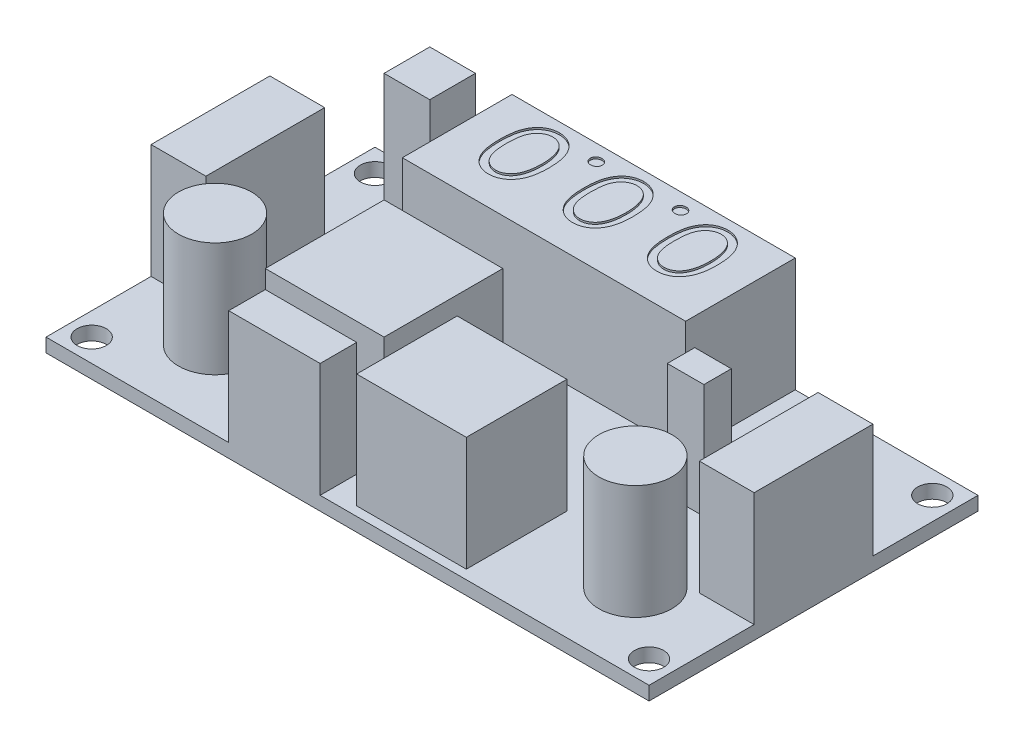
from build123d import *

# Parameters (mm, degrees)
SKETCH_2_W          = 66
SKETCH_2_H          = 36
EXTRUDE_1_DEPTH     = 1.5
SKETCH_3_R          = 4
SKETCH_3_W          = 6
SKETCH_3_H          = 13
SKETCH_3_W_2        = 10
SKETCH_3_H_2        = 4
SKETCH_3_W_3        = 12
SKETCH_3_H_3        = 11
SKETCH_3_W_4        = 5
SKETCH_3_H_4        = 5
SKETCH_3_W_5        = 31
SKETCH_3_H_5        = 12
SKETCH_3_W_6        = 4
SKETCH_3_H_6        = 3
SKETCH_3_W_7        = 13
EXTRUDE_2_DEPTH     = 12.5
SKETCH_3_2_R        = 4
SKETCH_3_2_W        = 6
SKETCH_3_2_H        = 13
SKETCH_3_2_W_2      = 10
SKETCH_3_2_H_2      = 4
SKETCH_3_2_W_3      = 12
SKETCH_3_2_H_3      = 11
SKETCH_3_2_W_4      = 5
SKETCH_3_2_H_4      = 5
SKETCH_3_2_W_5      = 31
SKETCH_3_2_H_5      = 12
SKETCH_3_2_W_6      = 4
SKETCH_3_2_H_6      = 3
SKETCH_3_2_W_7      = 13
EXTRUDE_3_DEPTH     = 8
CUT_EXTRUDE_1_DEPTH = 0.2
SKETCH_6_R          = 1.6
CUT_EXTRUDE_2_DEPTH = 40.613760313


with BuildPart() as part:
    # 스케치2 → 보스-돌출1 (new body)
    with BuildSketch(Plane(origin=(0, 0, 0), x_dir=(1, 0, 0), z_dir=(0, 1, 0))):
        Rectangle(SKETCH_2_W, SKETCH_2_H)
    extrude(amount=EXTRUDE_1_DEPTH)

    # 스케치3 → 보스-돌출2 (add)
    with BuildSketch(Plane(origin=(0, 1.5, 0), x_dir=(1, 0, 0), z_dir=(0, 1, 0))):
        with Locations(Location((-23, -9.5, 0), (0, 0, 270))):
            Circle(SKETCH_3_R)
        with Locations(Location((23, -9.5, 0), (0, 0, 270))):
            Circle(SKETCH_3_R)
        with Locations((-30, 0)):
            Rectangle(SKETCH_3_W, SKETCH_3_H)
        with Locations((30, 0)):
            Rectangle(SKETCH_3_W, SKETCH_3_H)
        with Locations((-8, -16)):
            Rectangle(SKETCH_3_W_2, SKETCH_3_H_2)
        with Locations((6, -11.5)):
            Rectangle(SKETCH_3_W_3, SKETCH_3_H_3)
        with Locations((-24.5, 15.5)):
            Rectangle(SKETCH_3_W_4, SKETCH_3_H_4)
        with Locations((-2.5, 12)):
            Rectangle(SKETCH_3_W_5, SKETCH_3_H_5)
        with Locations((18, 2.5)):
            Rectangle(SKETCH_3_W_6, SKETCH_3_H_6)
        with Locations((-8.5, -5.5)):
            Rectangle(SKETCH_3_W_7, SKETCH_3_H)
    extrude(amount=EXTRUDE_2_DEPTH)

    # 스케치3<2> → 보스-돌출3 (add)
    with BuildSketch(Plane(origin=(0, 1.5, 0), x_dir=(1, 0, 0), z_dir=(0, 1, 0))):
        with Locations(Location((-23, -9.5, 0), (0, 0, 270))):
            Circle(SKETCH_3_2_R)
        with Locations(Location((23, -9.5, 0), (0, 0, 270))):
            Circle(SKETCH_3_2_R)
        with Locations((-30, 0)):
            Rectangle(SKETCH_3_2_W, SKETCH_3_2_H)
        with Locations((30, 0)):
            Rectangle(SKETCH_3_2_W, SKETCH_3_2_H)
        with Locations((-8, -16)):
            Rectangle(SKETCH_3_2_W_2, SKETCH_3_2_H_2)
        with Locations((6, -11.5)):
            Rectangle(SKETCH_3_2_W_3, SKETCH_3_2_H_3)
        with Locations((-24.5, 15.5)):
            Rectangle(SKETCH_3_2_W_4, SKETCH_3_2_H_4)
        with Locations((-2.5, 12)):
            Rectangle(SKETCH_3_2_W_5, SKETCH_3_2_H_5)
        with Locations((18, 2.5)):
            Rectangle(SKETCH_3_2_W_6, SKETCH_3_2_H_6)
        with Locations((-8.5, -5.5)):
            Rectangle(SKETCH_3_2_W_7, SKETCH_3_2_H)
    extrude(amount=EXTRUDE_3_DEPTH)

    # 스케치5 → 컷-돌출1 (cut)
    # profile 1 of 5: a face of its own
    with BuildSketch(Plane(origin=(0, 14, 0), x_dir=(1, 0, 0), z_dir=(0, 1, 0))):
        with BuildLine():
            add(Edge.make_bspline(
                [(-14.419818376, 13.063179098), (-14.418459016, 12.944444114), (-14.415818517, 12.713806495), (-14.401742464, 12.377623704), (-14.375072763, 12.062285883), (-14.338366255, 11.767622044), (-14.291258931, 11.494143315), (-14.233785698, 11.241329327), (-14.165921461, 11.009173726), (-14.08708976, 10.796332931), (-13.996291215, 10.60125324), (-13.901260152, 10.417370578), (-13.792646448, 10.248348044), (-13.679613823, 10.088750778), (-13.555462792, 9.942822184), (-13.423164104, 9.808698659), (-13.281713588, 9.686647066), (-13.132298643, 9.577002326), (-12.975840609, 9.481002054), (-12.81604823, 9.39529753), (-12.650041611, 9.326069756), (-12.480114984, 9.267631823), (-12.305555526, 9.221707183), (-12.126003569, 9.188901012), (-11.942413032, 9.169178269), (-11.818342294, 9.167121264), (-11.755964543, 9.166087084)],
                knots=[0, 0, 0, 0, 1.603820526, 3.115352659, 4.543618507, 5.877090555, 7.12496949, 8.290358608, 9.377068129, 10.389796722, 11.352535243, 12.282078455, 13.182987931, 14.063801734, 14.921894113, 15.767618834, 16.606133584, 17.442729412, 18.267853256, 19.083809226, 19.889219235, 20.694268863, 21.509458471, 22.324620696, 23.157687019, 24, 24, 24, 24], degree=3))
            add(Edge.make_bspline(
                [(-11.755964543, 9.166087084), (-11.69257033, 9.16690151), (-11.566419047, 9.168522175), (-11.380312468, 9.19148061), (-11.19770383, 9.220760301), (-11.021186949, 9.268359278), (-10.847719579, 9.325052235), (-10.68084518, 9.399458018), (-10.515805598, 9.481566801), (-10.358097477, 9.580522072), (-10.203936192, 9.689211189), (-10.06127445, 9.814892935), (-9.924104025, 9.950558573), (-9.797633107, 10.101145387), (-9.675856772, 10.263018172), (-9.566344284, 10.440146462), (-9.460812173, 10.627841265), (-9.366069952, 10.830159173), (-9.280804448, 11.048606181), (-9.207099912, 11.284152788), (-9.145295108, 11.53761345), (-9.093214532, 11.807956477), (-9.053509164, 12.096776295), (-9.025825308, 12.403315593), (-9.009618399, 12.72761014), (-9.007251045, 12.949384031), (-9.006036325, 13.063179098)],
                knots=[0, 0, 0, 0, 0.849124811, 1.689715488, 2.510539114, 3.325908167, 4.137358647, 4.95402074, 5.772457427, 6.606036604, 7.446967172, 8.297773036, 9.151081389, 10.030648383, 10.931085971, 11.863757263, 12.819477044, 13.816090959, 14.855312144, 15.960468038, 17.121553026, 18.350425046, 19.649150068, 21.02744367, 22.474742705, 24, 24, 24, 24], degree=3))
            add(Edge.make_bspline(
                [(-9.006036325, 13.063179098), (-9.007278441, 13.176477245), (-9.009704332, 13.397752018), (-9.025555214, 13.720597001), (-9.054022307, 14.025503046), (-9.091749629, 14.312415479), (-9.142142352, 14.581955824), (-9.204041127, 14.833684681), (-9.276616925, 15.067727474), (-9.360017071, 15.284365234), (-9.453963412, 15.485301249), (-9.556642025, 15.673136859), (-9.668098934, 15.848694881), (-9.787609782, 16.011755946), (-9.916353135, 16.161369437), (-10.05321615, 16.298337681), (-10.198427595, 16.423111103), (-10.35218006, 16.534611271), (-10.511199629, 16.633710175), (-10.67625861, 16.718818508), (-10.845163966, 16.791820287), (-11.018931314, 16.850925721), (-11.196889706, 16.897788559), (-11.379177078, 16.929202062), (-11.565933658, 16.951916925), (-11.692079648, 16.953522052), (-11.755964543, 16.954334947)],
                knots=[0, 0, 0, 0, 1.520081338, 2.968765686, 4.335160859, 5.627652958, 6.849941718, 8.012138063, 9.103700889, 10.135327544, 11.12406934, 12.077498399, 13.005454381, 13.912089544, 14.787455801, 15.650966906, 16.507615292, 17.353240407, 18.196753249, 19.019005641, 19.842542719, 20.663186424, 21.479335924, 22.308629464, 23.143428747, 24, 24, 24, 24], degree=3))
            add(Edge.make_bspline(
                [(-11.755964543, 16.954334947), (-11.818341688, 16.953296613), (-11.942411219, 16.951231343), (-12.126010665, 16.93156962), (-12.30493591, 16.898646131), (-12.478894196, 16.853813035), (-12.648932924, 16.798490572), (-12.812579094, 16.725430206), (-12.972710281, 16.643110998), (-13.127767916, 16.547747688), (-13.275806978, 16.439769807), (-13.416191648, 16.318613834), (-13.54857588, 16.184970106), (-13.671616239, 16.037633487), (-13.785847073, 15.877914574), (-13.893450678, 15.706989196), (-13.99081019, 15.522611025), (-14.080716624, 15.325175956), (-14.161690637, 15.111370728), (-14.230453797, 14.878048128), (-14.29035399, 14.625031016), (-14.336271783, 14.351158474), (-14.375490591, 14.057771081), (-14.401658965, 13.743774006), (-14.415825702, 13.410083345), (-14.418463171, 13.18092632), (-14.419818376, 13.063179098)],
                knots=[0, 0, 0, 0, 0.843473943, 1.677688484, 2.493974249, 3.302130162, 4.106148564, 4.909164103, 5.723143196, 6.540196404, 7.368594906, 8.198828777, 9.045719163, 9.910110809, 10.79213864, 11.699953926, 12.639824269, 13.609976902, 14.632717004, 15.729243744, 16.897753418, 18.147352308, 19.483516926, 20.900417599, 22.407348784, 24, 24, 24, 24], degree=3))
        make_face()
        with BuildLine():
            add(Edge.make_bspline(
                [(-13.659989316, 13.060211016), (-13.658873768, 13.159150475), (-13.656708995, 13.351147005), (-13.647520584, 13.629888821), (-13.627185924, 13.890081948), (-13.603477383, 14.131916787), (-13.569370803, 14.35477627), (-13.527311107, 14.558568352), (-13.481735227, 14.744770661), (-13.423462793, 14.91244511), (-13.361751507, 15.067354092), (-13.289519363, 15.209804028), (-13.21234372, 15.343623747), (-13.129885232, 15.469470908), (-13.036911923, 15.583778211), (-12.937881322, 15.689137472), (-12.831672679, 15.784988188), (-12.683059682, 15.897805167), (-12.48839388, 16.016401008), (-12.242534857, 16.117996449), (-11.989762409, 16.182408036), (-11.818172202, 16.190468347), (-11.732219885, 16.194505888)],
                knots=[0, 0, 0, 0, 1.435237426, 2.785143622, 4.044295029, 5.220225752, 6.309111823, 7.312459854, 8.238306333, 9.086944801, 9.885090925, 10.655233517, 11.401058952, 12.125452561, 12.83479975, 13.535272674, 14.221150424, 14.907140765, 16.23985049, 17.51375832, 18.754601236, 20, 20, 20, 20], degree=3))
            add(Edge.make_bspline(
                [(-11.732219885, 16.194505888), (-11.645791965, 16.190986129), (-11.47382212, 16.183982693), (-11.220889101, 16.121297342), (-10.977182632, 16.021229784), (-10.784923902, 15.905240749), (-10.640185416, 15.793304662), (-10.5349456, 15.700005714), (-10.439372171, 15.593623562), (-10.348496999, 15.479594902), (-10.264453389, 15.355426645), (-10.189665717, 15.220372165), (-10.120752099, 15.075612907), (-10.081331437, 14.974398057), (-10.06118957, 14.922682637)],
                knots=[0, 0, 0, 0, 1.385185743, 2.756171583, 4.155232958, 5.601124949, 6.342661806, 7.090292893, 7.854473781, 8.634328457, 9.429191334, 10.257332522, 11.109589353, 12, 12, 12, 12], degree=3))
            add(Edge.make_bspline(
                [(-10.06118957, 14.922682637), (-10.037089396, 14.856675476), (-9.988278298, 14.722988388), (-9.929811715, 14.513914257), (-9.879417223, 14.296010021), (-9.837855087, 14.068202015), (-9.805483398, 13.830504845), (-9.781506837, 13.582516748), (-9.768440726, 13.324514326), (-9.766733139, 13.149267263), (-9.765865385, 13.060211016)],
                knots=[0, 0, 0, 0, 0.889220422, 1.800975616, 2.745784879, 3.719776404, 4.731116931, 5.781652937, 6.872690594, 8, 8, 8, 8], degree=3))
            add(Edge.make_bspline(
                [(-9.765865385, 13.060211016), (-9.766835718, 12.971158338), (-9.768734133, 12.796930713), (-9.780153382, 12.54194698), (-9.801331701, 12.299461586), (-9.828879468, 12.06910909), (-9.865579771, 11.851085325), (-9.911953164, 11.645711884), (-9.965069518, 11.45242692), (-10.025916384, 11.27106584), (-10.093502713, 11.10167809), (-10.170187576, 10.945189559), (-10.251220078, 10.799547064), (-10.338896235, 10.665558505), (-10.432436845, 10.543305162), (-10.532665547, 10.432610366), (-10.638734142, 10.332893065), (-10.78839697, 10.220162531), (-10.982343916, 10.102886486), (-11.226056916, 10.000411775), (-11.477383231, 9.938621465), (-11.647299325, 9.930150005), (-11.732219885, 9.925916144)],
                knots=[0, 0, 0, 0, 1.291783096, 2.527316474, 3.70124162, 4.821780852, 5.891736024, 6.906642583, 7.874574356, 8.798107533, 9.680207395, 10.517815698, 11.324198512, 12.096398539, 12.838403083, 13.554703878, 14.260431922, 14.946441027, 16.269337855, 17.536655128, 18.768871017, 20, 20, 20, 20], degree=3))
            add(Edge.make_bspline(
                [(-11.732219885, 9.925916144), (-11.818620613, 9.930101304), (-11.990498459, 9.938426887), (-12.243948367, 10.000067296), (-12.487822893, 10.103165851), (-12.682272223, 10.219171122), (-12.828801887, 10.332990808), (-12.934455106, 10.427763503), (-13.032953912, 10.532707762), (-13.125336401, 10.646905466), (-13.20901496, 10.771693114), (-13.287320678, 10.904542327), (-13.356499047, 11.047940578), (-13.421183319, 11.201557934), (-13.478143716, 11.370038895), (-13.526584767, 11.556082376), (-13.567783315, 11.761247806), (-13.601455694, 11.985147317), (-13.627761632, 12.227259499), (-13.647397171, 12.488075536), (-13.656746146, 12.767787043), (-13.658886512, 12.960775436), (-13.659989316, 13.060211016)],
                knots=[0, 0, 0, 0, 1.252453284, 2.491518031, 3.758701879, 5.08145943, 5.761706604, 6.447530903, 7.137806832, 7.84709874, 8.575440236, 9.315003832, 10.081904578, 10.882725146, 11.731297479, 12.65887722, 13.669177587, 14.765071275, 15.941676253, 17.200729533, 18.557700407, 20, 20, 20, 20], degree=3))
        make_face(mode=Mode.SUBTRACT)
    # profile 2 of 5: a face of its own
    with BuildSketch(Plane(origin=(0, 14, 0), x_dir=(1, 0, 0), z_dir=(0, 1, 0))):
        with BuildLine():
            add(Edge.make_bspline(
                [(-7.011485043, 15.624634093), (-6.966760584, 15.626994705), (-6.880011776, 15.631573415), (-6.754609424, 15.665132716), (-6.640425351, 15.72266729), (-6.538852461, 15.800866128), (-6.45446157, 15.894932601), (-6.391861839, 16.00111955), (-6.352590604, 16.118112487), (-6.348647161, 16.200134871), (-6.346634615, 16.241995204)],
                knots=[0, 0, 0, 0, 1.063945943, 2.063659206, 3.064204292, 4.088713827, 5.097882974, 6.053126296, 7.006408056, 8, 8, 8, 8], degree=3))
            add(Edge.make_bspline(
                [(-6.346634615, 16.241995204), (-6.34873731, 16.282855374), (-6.35290614, 16.363865259), (-6.391879252, 16.479876771), (-6.45439171, 16.586186004), (-6.539336901, 16.679998688), (-6.639868857, 16.760155804), (-6.75492917, 16.816850985), (-6.879727153, 16.852926239), (-6.966708368, 16.857171114), (-7.011485043, 16.859356315)],
                knots=[0, 0, 0, 0, 0.971742746, 1.926589353, 2.883400742, 3.894226478, 4.927644809, 5.929832326, 6.934307551, 8, 8, 8, 8], degree=3))
            add(Edge.make_bspline(
                [(-7.011485043, 16.859356315), (-7.056261717, 16.857171114), (-7.143242933, 16.852926239), (-7.268040916, 16.816850985), (-7.383101229, 16.760155804), (-7.483633185, 16.679998688), (-7.568578375, 16.586186004), (-7.631090833, 16.479876771), (-7.670063945, 16.363865259), (-7.674232775, 16.282855374), (-7.67633547, 16.241995204)],
                knots=[0, 0, 0, 0, 1.065692449, 2.070167674, 3.072355191, 4.105773522, 5.116599258, 6.073410647, 7.028257254, 8, 8, 8, 8], degree=3))
            add(Edge.make_bspline(
                [(-7.67633547, 16.241995204), (-7.674322924, 16.200134871), (-7.670379481, 16.118112487), (-7.631108246, 16.00111955), (-7.568508515, 15.894932601), (-7.484117624, 15.800866128), (-7.382544735, 15.72266729), (-7.268360662, 15.665132716), (-7.14295831, 15.631573415), (-7.056209502, 15.626994705), (-7.011485043, 15.624634093)],
                knots=[0, 0, 0, 0, 0.993591944, 1.946873704, 2.902117026, 3.911286173, 4.935795708, 5.936340794, 6.936054057, 8, 8, 8, 8], degree=3))
        make_face()
    # profile 3 of 5: a face of its own
    with BuildSketch(Plane(origin=(0, 14, 0), x_dir=(1, 0, 0), z_dir=(0, 1, 0))):
        with BuildLine():
            add(Edge.make_bspline(
                [(-5.206891026, 13.063179098), (-5.205531665, 12.944444114), (-5.202891167, 12.713806495), (-5.188815113, 12.377623704), (-5.162145412, 12.062285883), (-5.125438904, 11.767622044), (-5.078331581, 11.494143315), (-5.020858348, 11.241329327), (-4.952994111, 11.009173726), (-4.87416241, 10.796332931), (-4.783363865, 10.60125324), (-4.688332801, 10.417370578), (-4.579719098, 10.248348044), (-4.466686472, 10.088750778), (-4.342535442, 9.942822184), (-4.210236754, 9.808698659), (-4.068786238, 9.686647066), (-3.919371292, 9.577002326), (-3.762913259, 9.481002054), (-3.603120879, 9.39529753), (-3.437114261, 9.326069756), (-3.267187634, 9.267631823), (-3.092628175, 9.221707183), (-2.913076218, 9.188901012), (-2.729485682, 9.169178269), (-2.605414944, 9.167121264), (-2.543037193, 9.166087084)],
                knots=[0, 0, 0, 0, 1.603820526, 3.115352659, 4.543618507, 5.877090555, 7.12496949, 8.290358608, 9.377068129, 10.389796722, 11.352535243, 12.282078455, 13.182987931, 14.063801734, 14.921894113, 15.767618834, 16.606133584, 17.442729412, 18.267853256, 19.083809226, 19.889219235, 20.694268863, 21.509458471, 22.324620696, 23.157687019, 24, 24, 24, 24], degree=3))
            add(Edge.make_bspline(
                [(-2.543037193, 9.166087084), (-2.47964298, 9.16690151), (-2.353491697, 9.168522175), (-2.167385118, 9.19148061), (-1.984776479, 9.220760301), (-1.808259599, 9.268359278), (-1.634792229, 9.325052235), (-1.467917829, 9.399458018), (-1.302878248, 9.481566801), (-1.145170126, 9.580522072), (-0.991008842, 9.689211189), (-0.848347099, 9.814892935), (-0.711176675, 9.950558573), (-0.584705757, 10.101145387), (-0.462929422, 10.263018172), (-0.353416933, 10.440146462), (-0.247884822, 10.627841265), (-0.153142602, 10.830159173), (-0.067877098, 11.048606181), (0.005827438, 11.284152788), (0.067632243, 11.53761345), (0.119712819, 11.807956477), (0.159418187, 12.096776295), (0.187102042, 12.403315593), (0.203308952, 12.72761014), (0.205676306, 12.949384031), (0.206891026, 13.063179098)],
                knots=[0, 0, 0, 0, 0.849124811, 1.689715488, 2.510539114, 3.325908167, 4.137358647, 4.95402074, 5.772457427, 6.606036604, 7.446967172, 8.297773036, 9.151081389, 10.030648383, 10.931085971, 11.863757263, 12.819477044, 13.816090959, 14.855312144, 15.960468038, 17.121553026, 18.350425046, 19.649150068, 21.02744367, 22.474742705, 24, 24, 24, 24], degree=3))
            add(Edge.make_bspline(
                [(0.206891026, 13.063179098), (0.20564891, 13.176477245), (0.203223019, 13.397752018), (0.187372136, 13.720597001), (0.158905043, 14.025503046), (0.121177721, 14.312415479), (0.070784998, 14.581955824), (0.008886224, 14.833684681), (-0.063689574, 15.067727474), (-0.147089721, 15.284365234), (-0.241036062, 15.485301249), (-0.343714674, 15.673136859), (-0.455171583, 15.848694881), (-0.574682432, 16.011755946), (-0.703425785, 16.161369437), (-0.8402888, 16.298337681), (-0.985500245, 16.423111103), (-1.13925271, 16.534611271), (-1.298272279, 16.633710175), (-1.46333126, 16.718818508), (-1.632236616, 16.791820287), (-1.806003963, 16.850925721), (-1.983962356, 16.897788559), (-2.166249728, 16.929202062), (-2.353006307, 16.951916925), (-2.479152298, 16.953522052), (-2.543037193, 16.954334947)],
                knots=[0, 0, 0, 0, 1.520081338, 2.968765686, 4.335160859, 5.627652958, 6.849941718, 8.012138063, 9.103700889, 10.135327544, 11.12406934, 12.077498399, 13.005454381, 13.912089544, 14.787455801, 15.650966906, 16.507615292, 17.353240407, 18.196753249, 19.019005641, 19.842542719, 20.663186424, 21.479335924, 22.308629464, 23.143428747, 24, 24, 24, 24], degree=3))
            add(Edge.make_bspline(
                [(-2.543037193, 16.954334947), (-2.605414337, 16.953296613), (-2.729483869, 16.951231343), (-2.913083314, 16.93156962), (-3.092008559, 16.898646131), (-3.265966845, 16.853813035), (-3.436005573, 16.798490572), (-3.599651744, 16.725430206), (-3.759782931, 16.643110998), (-3.914840565, 16.547747688), (-4.062879628, 16.439769807), (-4.203264297, 16.318613834), (-4.33564853, 16.184970106), (-4.458688889, 16.037633487), (-4.572919722, 15.877914574), (-4.680523328, 15.706989196), (-4.777882839, 15.522611025), (-4.867789273, 15.325175956), (-4.948763286, 15.111370728), (-5.017526447, 14.878048128), (-5.077426639, 14.625031016), (-5.123344432, 14.351158474), (-5.162563241, 14.057771081), (-5.188731615, 13.743774006), (-5.202898352, 13.410083345), (-5.205535821, 13.18092632), (-5.206891026, 13.063179098)],
                knots=[0, 0, 0, 0, 0.843473943, 1.677688484, 2.493974249, 3.302130162, 4.106148564, 4.909164103, 5.723143196, 6.540196404, 7.368594906, 8.198828777, 9.045719163, 9.910110809, 10.79213864, 11.699953926, 12.639824269, 13.609976902, 14.632717004, 15.729243744, 16.897753418, 18.147352308, 19.483516926, 20.900417599, 22.407348784, 24, 24, 24, 24], degree=3))
        make_face()
        with BuildLine():
            add(Edge.make_bspline(
                [(-4.447061966, 13.060211016), (-4.445946417, 13.159150475), (-4.443781645, 13.351147005), (-4.434593234, 13.629888821), (-4.414258574, 13.890081948), (-4.390550033, 14.131916787), (-4.356443452, 14.35477627), (-4.314383756, 14.558568352), (-4.268807877, 14.744770661), (-4.210535443, 14.91244511), (-4.148824156, 15.067354092), (-4.076592013, 15.209804028), (-3.999416369, 15.343623747), (-3.916957882, 15.469470908), (-3.823984573, 15.583778211), (-3.724953972, 15.689137472), (-3.618745329, 15.784988188), (-3.470132332, 15.897805167), (-3.27546653, 16.016401008), (-3.029607507, 16.117996449), (-2.776835058, 16.182408036), (-2.605244851, 16.190468347), (-2.519292535, 16.194505888)],
                knots=[0, 0, 0, 0, 1.435237426, 2.785143622, 4.044295029, 5.220225752, 6.309111823, 7.312459854, 8.238306333, 9.086944801, 9.885090925, 10.655233517, 11.401058952, 12.125452561, 12.83479975, 13.535272674, 14.221150424, 14.907140765, 16.23985049, 17.51375832, 18.754601236, 20, 20, 20, 20], degree=3))
            add(Edge.make_bspline(
                [(-2.519292535, 16.194505888), (-2.432864615, 16.190986129), (-2.26089477, 16.183982693), (-2.007961751, 16.121297342), (-1.764255282, 16.021229784), (-1.571996552, 15.905240749), (-1.427258065, 15.793304662), (-1.32201825, 15.700005714), (-1.226444821, 15.593623562), (-1.135569648, 15.479594902), (-1.051526039, 15.355426645), (-0.976738367, 15.220372165), (-0.907824748, 15.075612907), (-0.868404087, 14.974398057), (-0.84826222, 14.922682637)],
                knots=[0, 0, 0, 0, 1.385185743, 2.756171583, 4.155232958, 5.601124949, 6.342661806, 7.090292893, 7.854473781, 8.634328457, 9.429191334, 10.257332522, 11.109589353, 12, 12, 12, 12], degree=3))
            add(Edge.make_bspline(
                [(-0.84826222, 14.922682637), (-0.824162046, 14.856675476), (-0.775350948, 14.722988388), (-0.716884364, 14.513914257), (-0.666489873, 14.296010021), (-0.624927736, 14.068202015), (-0.592556047, 13.830504845), (-0.568579486, 13.582516748), (-0.555513376, 13.324514326), (-0.553805788, 13.149267263), (-0.552938034, 13.060211016)],
                knots=[0, 0, 0, 0, 0.889220422, 1.800975616, 2.745784879, 3.719776404, 4.731116931, 5.781652937, 6.872690594, 8, 8, 8, 8], degree=3))
            add(Edge.make_bspline(
                [(-0.552938034, 13.060211016), (-0.553908368, 12.971158338), (-0.555806783, 12.796930713), (-0.567226032, 12.54194698), (-0.588404351, 12.299461586), (-0.615952118, 12.06910909), (-0.65265242, 11.851085325), (-0.699025814, 11.645711884), (-0.752142167, 11.45242692), (-0.812989033, 11.27106584), (-0.880575363, 11.10167809), (-0.957260226, 10.945189559), (-1.038292727, 10.799547064), (-1.125968885, 10.665558505), (-1.219509494, 10.543305162), (-1.319738197, 10.432610366), (-1.425806792, 10.332893065), (-1.57546962, 10.220162531), (-1.769416566, 10.102886486), (-2.013129566, 10.000411775), (-2.264455881, 9.938621465), (-2.434371974, 9.930150005), (-2.519292535, 9.925916144)],
                knots=[0, 0, 0, 0, 1.291783096, 2.527316474, 3.70124162, 4.821780852, 5.891736024, 6.906642583, 7.874574356, 8.798107533, 9.680207395, 10.517815698, 11.324198512, 12.096398539, 12.838403083, 13.554703878, 14.260431922, 14.946441027, 16.269337855, 17.536655128, 18.768871017, 20, 20, 20, 20], degree=3))
            add(Edge.make_bspline(
                [(-2.519292535, 9.925916144), (-2.605693263, 9.930101304), (-2.777571109, 9.938426887), (-3.031021017, 10.000067296), (-3.274895543, 10.103165851), (-3.469344873, 10.219171122), (-3.615874537, 10.332990808), (-3.721527756, 10.427763503), (-3.820026561, 10.532707762), (-3.91240905, 10.646905466), (-3.99608761, 10.771693114), (-4.074393328, 10.904542327), (-4.143571697, 11.047940578), (-4.208255969, 11.201557934), (-4.265216366, 11.370038895), (-4.313657416, 11.556082376), (-4.354855964, 11.761247806), (-4.388528343, 11.985147317), (-4.414834281, 12.227259499), (-4.43446982, 12.488075536), (-4.443818795, 12.767787043), (-4.445959161, 12.960775436), (-4.447061966, 13.060211016)],
                knots=[0, 0, 0, 0, 1.252453284, 2.491518031, 3.758701879, 5.08145943, 5.761706604, 6.447530903, 7.137806832, 7.84709874, 8.575440236, 9.315003832, 10.081904578, 10.882725146, 11.731297479, 12.65887722, 13.669177587, 14.765071275, 15.941676253, 17.200729533, 18.557700407, 20, 20, 20, 20], degree=3))
        make_face(mode=Mode.SUBTRACT)
    # profile 4 of 5: a face of its own
    with BuildSketch(Plane(origin=(0, 14, 0), x_dir=(1, 0, 0), z_dir=(0, 1, 0))):
        with BuildLine():
            add(Edge.make_bspline(
                [(2.201442308, 15.624634093), (2.246166767, 15.626994705), (2.332915574, 15.631573415), (2.458317927, 15.665132716), (2.572501999, 15.72266729), (2.674074889, 15.800866128), (2.75846578, 15.894932601), (2.821065511, 16.00111955), (2.860336746, 16.118112487), (2.864280189, 16.200134871), (2.866292735, 16.241995204)],
                knots=[0, 0, 0, 0, 1.063945943, 2.063659206, 3.064204292, 4.088713827, 5.097882974, 6.053126296, 7.006408056, 8, 8, 8, 8], degree=3))
            add(Edge.make_bspline(
                [(2.866292735, 16.241995204), (2.86419004, 16.282855374), (2.86002121, 16.363865259), (2.821048098, 16.479876771), (2.75853564, 16.586186004), (2.67359045, 16.679998688), (2.573058494, 16.760155804), (2.457998181, 16.816850985), (2.333200198, 16.852926239), (2.246218982, 16.857171114), (2.201442308, 16.859356315)],
                knots=[0, 0, 0, 0, 0.971742746, 1.926589353, 2.883400742, 3.894226478, 4.927644809, 5.929832326, 6.934307551, 8, 8, 8, 8], degree=3))
            add(Edge.make_bspline(
                [(2.201442308, 16.859356315), (2.156665633, 16.857171114), (2.069684418, 16.852926239), (1.944886435, 16.816850985), (1.829826122, 16.760155804), (1.729294166, 16.679998688), (1.644348975, 16.586186004), (1.581836517, 16.479876771), (1.542863405, 16.363865259), (1.538694575, 16.282855374), (1.53659188, 16.241995204)],
                knots=[0, 0, 0, 0, 1.065692449, 2.070167674, 3.072355191, 4.105773522, 5.116599258, 6.073410647, 7.028257254, 8, 8, 8, 8], degree=3))
            add(Edge.make_bspline(
                [(1.53659188, 16.241995204), (1.538604426, 16.200134871), (1.542547869, 16.118112487), (1.581819104, 16.00111955), (1.644418835, 15.894932601), (1.728809726, 15.800866128), (1.830382616, 15.72266729), (1.944566689, 15.665132716), (2.069969041, 15.631573415), (2.156717849, 15.626994705), (2.201442308, 15.624634093)],
                knots=[0, 0, 0, 0, 0.993591944, 1.946873704, 2.902117026, 3.911286173, 4.935795708, 5.936340794, 6.936054057, 8, 8, 8, 8], degree=3))
        make_face()
    # profile 5 of 5: a face of its own
    with BuildSketch(Plane(origin=(0, 14, 0), x_dir=(1, 0, 0), z_dir=(0, 1, 0))):
        with BuildLine():
            add(Edge.make_bspline(
                [(4.006036325, 13.063179098), (4.007395685, 12.944444114), (4.010036184, 12.713806495), (4.024112237, 12.377623704), (4.050781938, 12.062285883), (4.087488446, 11.767622044), (4.13459577, 11.494143315), (4.192069003, 11.241329327), (4.25993324, 11.009173726), (4.33876494, 10.796332931), (4.429563486, 10.60125324), (4.524594549, 10.417370578), (4.633208253, 10.248348044), (4.746240878, 10.088750778), (4.870391909, 9.942822184), (5.002690597, 9.808698659), (5.144141113, 9.686647066), (5.293556058, 9.577002326), (5.450014091, 9.481002054), (5.609806471, 9.39529753), (5.77581309, 9.326069756), (5.945739717, 9.267631823), (6.120299175, 9.221707183), (6.299851132, 9.188901012), (6.483441669, 9.169178269), (6.607512407, 9.167121264), (6.669890158, 9.166087084)],
                knots=[0, 0, 0, 0, 1.603820526, 3.115352659, 4.543618507, 5.877090555, 7.12496949, 8.290358608, 9.377068129, 10.389796722, 11.352535243, 12.282078455, 13.182987931, 14.063801734, 14.921894113, 15.767618834, 16.606133584, 17.442729412, 18.267853256, 19.083809226, 19.889219235, 20.694268863, 21.509458471, 22.324620696, 23.157687019, 24, 24, 24, 24], degree=3))
            add(Edge.make_bspline(
                [(6.669890158, 9.166087084), (6.733284371, 9.16690151), (6.859435653, 9.168522175), (7.045542233, 9.19148061), (7.228150871, 9.220760301), (7.404667752, 9.268359278), (7.578135121, 9.325052235), (7.745009521, 9.399458018), (7.910049103, 9.481566801), (8.067757224, 9.580522072), (8.221918508, 9.689211189), (8.364580251, 9.814892935), (8.501750675, 9.950558573), (8.628221594, 10.101145387), (8.749997929, 10.263018172), (8.859510417, 10.440146462), (8.965042528, 10.627841265), (9.059784749, 10.830159173), (9.145050253, 11.048606181), (9.218754788, 11.284152788), (9.280559593, 11.53761345), (9.332640169, 11.807956477), (9.372345537, 12.096776295), (9.400029393, 12.403315593), (9.416236302, 12.72761014), (9.418603656, 12.949384031), (9.419818376, 13.063179098)],
                knots=[0, 0, 0, 0, 0.849124811, 1.689715488, 2.510539114, 3.325908167, 4.137358647, 4.95402074, 5.772457427, 6.606036604, 7.446967172, 8.297773036, 9.151081389, 10.030648383, 10.931085971, 11.863757263, 12.819477044, 13.816090959, 14.855312144, 15.960468038, 17.121553026, 18.350425046, 19.649150068, 21.02744367, 22.474742705, 24, 24, 24, 24], degree=3))
            add(Edge.make_bspline(
                [(9.419818376, 13.063179098), (9.41857626, 13.176477245), (9.416150369, 13.397752018), (9.400299487, 13.720597001), (9.371832394, 14.025503046), (9.334105072, 14.312415479), (9.283712349, 14.581955824), (9.221813574, 14.833684681), (9.149237776, 15.067727474), (9.06583763, 15.284365234), (8.971891288, 15.485301249), (8.869212676, 15.673136859), (8.757755767, 15.848694881), (8.638244919, 16.011755946), (8.509501566, 16.161369437), (8.372638551, 16.298337681), (8.227427106, 16.423111103), (8.07367464, 16.534611271), (7.914655071, 16.633710175), (7.749596091, 16.718818508), (7.580690735, 16.791820287), (7.406923387, 16.850925721), (7.228964994, 16.897788559), (7.046677623, 16.929202062), (6.859921043, 16.951916925), (6.733775053, 16.953522052), (6.669890158, 16.954334947)],
                knots=[0, 0, 0, 0, 1.520081338, 2.968765686, 4.335160859, 5.627652958, 6.849941718, 8.012138063, 9.103700889, 10.135327544, 11.12406934, 12.077498399, 13.005454381, 13.912089544, 14.787455801, 15.650966906, 16.507615292, 17.353240407, 18.196753249, 19.019005641, 19.842542719, 20.663186424, 21.479335924, 22.308629464, 23.143428747, 24, 24, 24, 24], degree=3))
            add(Edge.make_bspline(
                [(6.669890158, 16.954334947), (6.607513013, 16.953296613), (6.483443482, 16.951231343), (6.299844036, 16.93156962), (6.120918791, 16.898646131), (5.946960505, 16.853813035), (5.776921777, 16.798490572), (5.613275607, 16.725430206), (5.45314442, 16.643110998), (5.298086785, 16.547747688), (5.150047723, 16.439769807), (5.009663053, 16.318613834), (4.877278821, 16.184970106), (4.754238462, 16.037633487), (4.640007628, 15.877914574), (4.532404022, 15.706989196), (4.435044511, 15.522611025), (4.345138077, 15.325175956), (4.264164064, 15.111370728), (4.195400904, 14.878048128), (4.135500711, 14.625031016), (4.089582918, 14.351158474), (4.05036411, 14.057771081), (4.024195735, 13.743774006), (4.010028999, 13.410083345), (4.00739153, 13.18092632), (4.006036325, 13.063179098)],
                knots=[0, 0, 0, 0, 0.843473943, 1.677688484, 2.493974249, 3.302130162, 4.106148564, 4.909164103, 5.723143196, 6.540196404, 7.368594906, 8.198828777, 9.045719163, 9.910110809, 10.79213864, 11.699953926, 12.639824269, 13.609976902, 14.632717004, 15.729243744, 16.897753418, 18.147352308, 19.483516926, 20.900417599, 22.407348784, 24, 24, 24, 24], degree=3))
        make_face()
        with BuildLine():
            add(Edge.make_bspline(
                [(4.765865385, 13.060211016), (4.766980933, 13.159150475), (4.769145706, 13.351147005), (4.778334117, 13.629888821), (4.798668776, 13.890081948), (4.822377317, 14.131916787), (4.856483898, 14.35477627), (4.898543594, 14.558568352), (4.944119474, 14.744770661), (5.002391908, 14.91244511), (5.064103194, 15.067354092), (5.136335337, 15.209804028), (5.213510981, 15.343623747), (5.295969469, 15.469470908), (5.388942778, 15.583778211), (5.487973379, 15.689137472), (5.594182022, 15.784988188), (5.742795018, 15.897805167), (5.937460821, 16.016401008), (6.183319844, 16.117996449), (6.436092292, 16.182408036), (6.607682499, 16.190468347), (6.693634816, 16.194505888)],
                knots=[0, 0, 0, 0, 1.435237426, 2.785143622, 4.044295029, 5.220225752, 6.309111823, 7.312459854, 8.238306333, 9.086944801, 9.885090925, 10.655233517, 11.401058952, 12.125452561, 12.83479975, 13.535272674, 14.221150424, 14.907140765, 16.23985049, 17.51375832, 18.754601236, 20, 20, 20, 20], degree=3))
            add(Edge.make_bspline(
                [(6.693634816, 16.194505888), (6.780062736, 16.190986129), (6.952032581, 16.183982693), (7.2049656, 16.121297342), (7.448672069, 16.021229784), (7.640930799, 15.905240749), (7.785669285, 15.793304662), (7.890909101, 15.700005714), (7.98648253, 15.593623562), (8.077357702, 15.479594902), (8.161401312, 15.355426645), (8.236188984, 15.220372165), (8.305102602, 15.075612907), (8.344523264, 14.974398057), (8.364665131, 14.922682637)],
                knots=[0, 0, 0, 0, 1.385185743, 2.756171583, 4.155232958, 5.601124949, 6.342661806, 7.090292893, 7.854473781, 8.634328457, 9.429191334, 10.257332522, 11.109589353, 12, 12, 12, 12], degree=3))
            add(Edge.make_bspline(
                [(8.364665131, 14.922682637), (8.388765305, 14.856675476), (8.437576403, 14.722988388), (8.496042986, 14.513914257), (8.546437478, 14.296010021), (8.587999614, 14.068202015), (8.620371303, 13.830504845), (8.644347864, 13.582516748), (8.657413974, 13.324514326), (8.659121562, 13.149267263), (8.659989316, 13.060211016)],
                knots=[0, 0, 0, 0, 0.889220422, 1.800975616, 2.745784879, 3.719776404, 4.731116931, 5.781652937, 6.872690594, 8, 8, 8, 8], degree=3))
            add(Edge.make_bspline(
                [(8.659989316, 13.060211016), (8.659018983, 12.971158338), (8.657120568, 12.796930713), (8.645701319, 12.54194698), (8.624523, 12.299461586), (8.596975232, 12.06910909), (8.56027493, 11.851085325), (8.513901536, 11.645711884), (8.460785183, 11.45242692), (8.399938317, 11.27106584), (8.332351987, 11.10167809), (8.255667125, 10.945189559), (8.174634623, 10.799547064), (8.086958466, 10.665558505), (7.993417856, 10.543305162), (7.893189154, 10.432610366), (7.787120559, 10.332893065), (7.637457731, 10.220162531), (7.443510785, 10.102886486), (7.199797785, 10.000411775), (6.94847147, 9.938621465), (6.778555376, 9.930150005), (6.693634816, 9.925916144)],
                knots=[0, 0, 0, 0, 1.291783096, 2.527316474, 3.70124162, 4.821780852, 5.891736024, 6.906642583, 7.874574356, 8.798107533, 9.680207395, 10.517815698, 11.324198512, 12.096398539, 12.838403083, 13.554703878, 14.260431922, 14.946441027, 16.269337855, 17.536655128, 18.768871017, 20, 20, 20, 20], degree=3))
            add(Edge.make_bspline(
                [(6.693634816, 9.925916144), (6.607234087, 9.930101304), (6.435356241, 9.938426887), (6.181906333, 10.000067296), (5.938031807, 10.103165851), (5.743582478, 10.219171122), (5.597052814, 10.332990808), (5.491399595, 10.427763503), (5.392900789, 10.532707762), (5.3005183, 10.646905466), (5.216839741, 10.771693114), (5.138534023, 10.904542327), (5.069355654, 11.047940578), (5.004671381, 11.201557934), (4.947710985, 11.370038895), (4.899269934, 11.556082376), (4.858071386, 11.761247806), (4.824399007, 11.985147317), (4.798093069, 12.227259499), (4.77845753, 12.488075536), (4.769108555, 12.767787043), (4.766968189, 12.960775436), (4.765865385, 13.060211016)],
                knots=[0, 0, 0, 0, 1.252453284, 2.491518031, 3.758701879, 5.08145943, 5.761706604, 6.447530903, 7.137806832, 7.84709874, 8.575440236, 9.315003832, 10.081904578, 10.882725146, 11.731297479, 12.65887722, 13.669177587, 14.765071275, 15.941676253, 17.200729533, 18.557700407, 20, 20, 20, 20], degree=3))
        make_face(mode=Mode.SUBTRACT)
    extrude(amount=-CUT_EXTRUDE_1_DEPTH, mode=Mode.SUBTRACT)

    # 스케치6 → 컷-돌출2 (cut, through all)
    with BuildSketch(Plane(origin=(0, 1.5, 0), x_dir=(1, 0, 0), z_dir=(0, 1, 0))):
        with Locations(Location((-30.5, 15.5, 0), (0, 0, 270))):
            Circle(SKETCH_6_R)
        with Locations(Location((30.5, 15.5, 0), (0, 0, 270))):
            Circle(SKETCH_6_R)
        with Locations(Location((30.5, -15.5, 0), (0, 0, 270))):
            Circle(SKETCH_6_R)
        with Locations(Location((-30.5, -15.5, 0), (0, 0, 270))):
            Circle(SKETCH_6_R)
    extrude(amount=-CUT_EXTRUDE_2_DEPTH, mode=Mode.SUBTRACT)


solid = part.part
